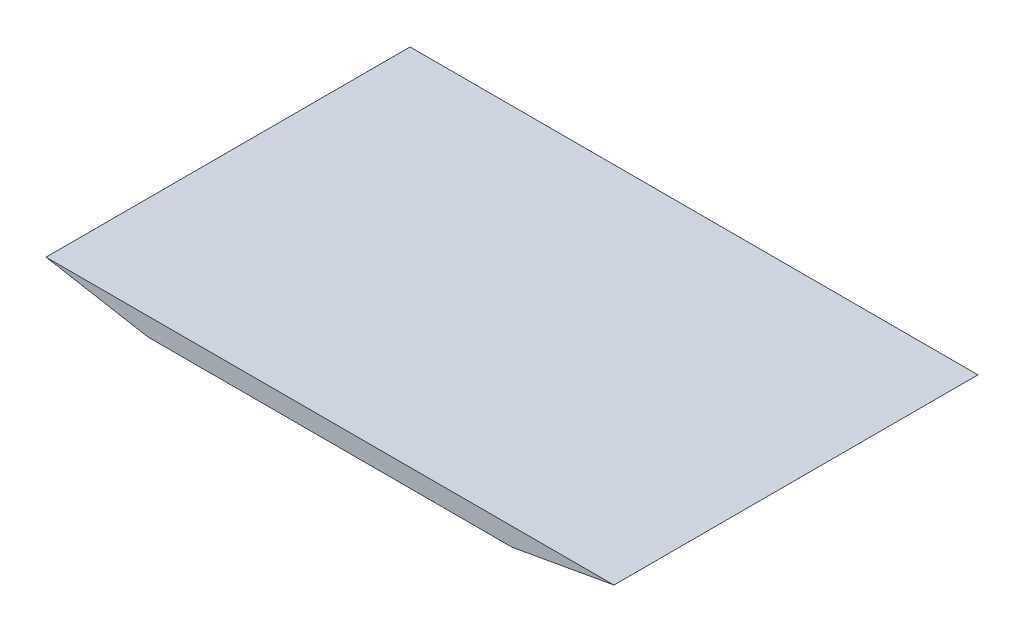
from build123d import *

# Parameters (mm, degrees)
BOSS_EXTRUDE1_DEPTH = 100


with BuildPart() as part:
    # Sketch1 → Boss-Extrude1 (new body)
    with BuildSketch(Plane.XY):
        Polygon((0, 0), (156, 0), (128, -5), (28, -5), align=None)
    extrude(amount=BOSS_EXTRUDE1_DEPTH)


solid = part.part
